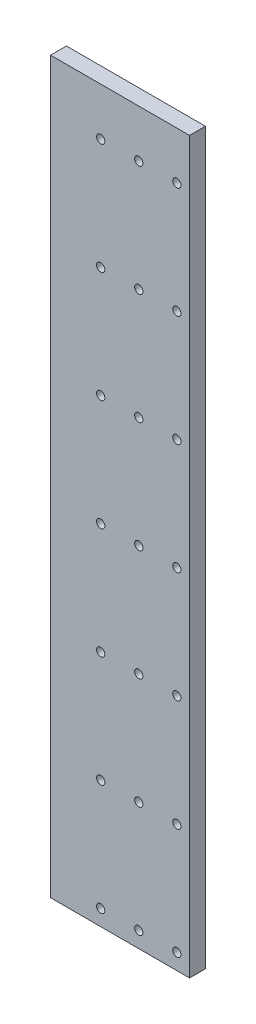
from build123d import *

# Parameters (mm, degrees)
MAIN_W                                    = 43.8
MAIN_H                                    = 230
MAIN_EXTRUSION_DEPTH                      = 2.5
MAIN_FIX_SKETCH_W                         = 8
MAIN_FIX_SKETCH_H                         = 230
MAIN_FIX_EXTRUSION_DEPTH                  = 2.5
MAIN_FIX_HOLE_SKETCH_R                    = 1.3
MAIN_FIX_HOLE_DEPTH                       = 250.664571611
MAIN_FIX_HOLE_HORIZONTAL_REPEAT_COUNT     = 3
MAIN_FIX_HOLE_HORIZONTAL_REPEAT_PITCH     = 12
FIX_HOLE_VERTICAL_REPEAT_COUNT            = 7
FIX_HOLE_VERTICAL_REPEAT_PITCH            = 35
FIX_HOLE_VERTICAL_REPEAT_COPY_1_SKETCH_R  = 1.3
FIX_HOLE_VERTICAL_REPEAT_COPY_1_DEPTH     = 250.664571611
FIX_HOLE_VERTICAL_REPEAT_COPY_2_SKETCH_R  = 1.3
FIX_HOLE_VERTICAL_REPEAT_COPY_2_DEPTH     = 250.664571611
FIX_HOLE_VERTICAL_REPEAT_COPY_3_SKETCH_R  = 1.3
FIX_HOLE_VERTICAL_REPEAT_COPY_3_DEPTH     = 250.664571611
FIX_HOLE_VERTICAL_REPEAT_COPY_4_SKETCH_R  = 1.3
FIX_HOLE_VERTICAL_REPEAT_COPY_4_DEPTH     = 250.664571611
FIX_HOLE_VERTICAL_REPEAT_COPY_5_SKETCH_R  = 1.3
FIX_HOLE_VERTICAL_REPEAT_COPY_5_DEPTH     = 250.664571611
FIX_HOLE_VERTICAL_REPEAT_COPY_6_SKETCH_R  = 1.3
FIX_HOLE_VERTICAL_REPEAT_COPY_6_DEPTH     = 250.664571611
FIX_HOLE_VERTICAL_REPEAT_COPY_7_SKETCH_R  = 1.3
FIX_HOLE_VERTICAL_REPEAT_COPY_7_DEPTH     = 250.664571611
FIX_HOLE_VERTICAL_REPEAT_COPY_8_SKETCH_R  = 1.3
FIX_HOLE_VERTICAL_REPEAT_COPY_8_DEPTH     = 250.664571611
FIX_HOLE_VERTICAL_REPEAT_COPY_9_SKETCH_R  = 1.3
FIX_HOLE_VERTICAL_REPEAT_COPY_9_DEPTH     = 250.664571611
FIX_HOLE_VERTICAL_REPEAT_COPY_10_SKETCH_R = 1.3
FIX_HOLE_VERTICAL_REPEAT_COPY_10_DEPTH    = 250.664571611
FIX_HOLE_VERTICAL_REPEAT_COPY_11_SKETCH_R = 1.3
FIX_HOLE_VERTICAL_REPEAT_COPY_11_DEPTH    = 250.664571611
FIX_HOLE_VERTICAL_REPEAT_COPY_12_SKETCH_R = 1.3
FIX_HOLE_VERTICAL_REPEAT_COPY_12_DEPTH    = 250.664571611
VERTICAL_RAINURE_W                        = 5
VERTICAL_RAINURE_H                        = 230
VERTICAL_RAINURE_EXTRUSION_DEPTH          = 2.5
HORIZONTAL_RAINURE_W                      = 30.8
HORIZONTAL_RAINURE_H                      = 6
HORIZONTAL_RAINURE_EXTRUSION_DEPTH        = 2.5
R_P_TITION_LIN_AIRE1_COUNT                = 8
R_P_TITION_LIN_AIRE1_PITCH                = 32
R_P_TITION_LIN_AIRE2_COUNT                = 2
R_P_TITION_LIN_AIRE2_PITCH                = 18
SLOT_SKETCH_EXTRUSION_DEPTH               = 40
CLIP_FIX_SKETCH_W                         = 2
CLIP_FIX_SKETCH_H                         = 4
SLOT_HOLE_SKETCH_R                        = 1.3
SLOT_HOLE_EXTRUSION_DEPTH                 = 246.570845175
SLOT_HOLE_HEAD_R                          = 3
SLOT_HOLE_HEAD_EXTRUSION_DEPTH            = 3
R_P_TITION_LIN_AIRE3_COUNT                = 3
R_P_TITION_LIN_AIRE3_PITCH                = 80


with BuildPart() as part:
    # Main → Main Extrusion (new body)
    with BuildSketch(Plane.XY):
        with Locations((46.710482565, 125)):
            Rectangle(MAIN_W, MAIN_H)
    extrude(amount=MAIN_EXTRUSION_DEPTH)

    # Main Fix Sketch → Main Fix - Extrusion (add)
    with BuildSketch(Plane(origin=(0, 0, 0), x_dir=(-1, 0, 0), z_dir=(0, 0, -1))):
        with Locations((-64.610482565, 125)):
            Rectangle(MAIN_FIX_SKETCH_W, MAIN_FIX_SKETCH_H)
    extrude(amount=MAIN_FIX_EXTRUSION_DEPTH)

    # Main Fix Hole Sketch → Main Fix Hole (cut, through all)
    with BuildSketch(Plane.XY.offset(2.5)):
        with Locations((64.610482565, 225)):
            Circle(MAIN_FIX_HOLE_SKETCH_R)
    main_fix_hole = extrude(amount=-MAIN_FIX_HOLE_DEPTH, mode=Mode.SUBTRACT)

    # Main Fix Hole Horizontal Repeat: Main Fix Hole ×3
    with Locations(*[(-i * MAIN_FIX_HOLE_HORIZONTAL_REPEAT_PITCH, 0, 0) for i in range(1, MAIN_FIX_HOLE_HORIZONTAL_REPEAT_COUNT)]):
        add(main_fix_hole, mode=Mode.SUBTRACT)

    # Fix Hole Vertical Repeat: Main Fix Hole ×7
    with Locations(*[(0, -i * FIX_HOLE_VERTICAL_REPEAT_PITCH, 0) for i in range(1, FIX_HOLE_VERTICAL_REPEAT_COUNT)]):
        add(main_fix_hole, mode=Mode.SUBTRACT)

    # Fix Hole Vertical Repeat copy 1 sketch → Fix Hole Vertical Repeat copy 1 (cut, through all)
    with BuildSketch(Plane(origin=(-12, -35, 2.5), x_dir=(1, 0, 0), z_dir=(0, 0, 1))):
        with Locations((64.610482565, 225)):
            Circle(FIX_HOLE_VERTICAL_REPEAT_COPY_1_SKETCH_R)
    extrude(amount=-FIX_HOLE_VERTICAL_REPEAT_COPY_1_DEPTH, mode=Mode.SUBTRACT)

    # Fix Hole Vertical Repeat copy 2 sketch → Fix Hole Vertical Repeat copy 2 (cut, through all)
    with BuildSketch(Plane(origin=(-12, -70, 2.5), x_dir=(1, 0, 0), z_dir=(0, 0, 1))):
        with Locations((64.610482565, 225)):
            Circle(FIX_HOLE_VERTICAL_REPEAT_COPY_2_SKETCH_R)
    extrude(amount=-FIX_HOLE_VERTICAL_REPEAT_COPY_2_DEPTH, mode=Mode.SUBTRACT)

    # Fix Hole Vertical Repeat copy 3 sketch → Fix Hole Vertical Repeat copy 3 (cut, through all)
    with BuildSketch(Plane(origin=(-12, -105, 2.5), x_dir=(1, 0, 0), z_dir=(0, 0, 1))):
        with Locations((64.610482565, 225)):
            Circle(FIX_HOLE_VERTICAL_REPEAT_COPY_3_SKETCH_R)
    extrude(amount=-FIX_HOLE_VERTICAL_REPEAT_COPY_3_DEPTH, mode=Mode.SUBTRACT)

    # Fix Hole Vertical Repeat copy 4 sketch → Fix Hole Vertical Repeat copy 4 (cut, through all)
    with BuildSketch(Plane(origin=(-12, -140, 2.5), x_dir=(1, 0, 0), z_dir=(0, 0, 1))):
        with Locations((64.610482565, 225)):
            Circle(FIX_HOLE_VERTICAL_REPEAT_COPY_4_SKETCH_R)
    extrude(amount=-FIX_HOLE_VERTICAL_REPEAT_COPY_4_DEPTH, mode=Mode.SUBTRACT)

    # Fix Hole Vertical Repeat copy 5 sketch → Fix Hole Vertical Repeat copy 5 (cut, through all)
    with BuildSketch(Plane(origin=(-12, -175, 2.5), x_dir=(1, 0, 0), z_dir=(0, 0, 1))):
        with Locations((64.610482565, 225)):
            Circle(FIX_HOLE_VERTICAL_REPEAT_COPY_5_SKETCH_R)
    extrude(amount=-FIX_HOLE_VERTICAL_REPEAT_COPY_5_DEPTH, mode=Mode.SUBTRACT)

    # Fix Hole Vertical Repeat copy 6 sketch → Fix Hole Vertical Repeat copy 6 (cut, through all)
    with BuildSketch(Plane(origin=(-12, -210, 2.5), x_dir=(1, 0, 0), z_dir=(0, 0, 1))):
        with Locations((64.610482565, 225)):
            Circle(FIX_HOLE_VERTICAL_REPEAT_COPY_6_SKETCH_R)
    extrude(amount=-FIX_HOLE_VERTICAL_REPEAT_COPY_6_DEPTH, mode=Mode.SUBTRACT)

    # Fix Hole Vertical Repeat copy 7 sketch → Fix Hole Vertical Repeat copy 7 (cut, through all)
    with BuildSketch(Plane(origin=(-24, -35, 2.5), x_dir=(1, 0, 0), z_dir=(0, 0, 1))):
        with Locations((64.610482565, 225)):
            Circle(FIX_HOLE_VERTICAL_REPEAT_COPY_7_SKETCH_R)
    extrude(amount=-FIX_HOLE_VERTICAL_REPEAT_COPY_7_DEPTH, mode=Mode.SUBTRACT)

    # Fix Hole Vertical Repeat copy 8 sketch → Fix Hole Vertical Repeat copy 8 (cut, through all)
    with BuildSketch(Plane(origin=(-24, -70, 2.5), x_dir=(1, 0, 0), z_dir=(0, 0, 1))):
        with Locations((64.610482565, 225)):
            Circle(FIX_HOLE_VERTICAL_REPEAT_COPY_8_SKETCH_R)
    extrude(amount=-FIX_HOLE_VERTICAL_REPEAT_COPY_8_DEPTH, mode=Mode.SUBTRACT)

    # Fix Hole Vertical Repeat copy 9 sketch → Fix Hole Vertical Repeat copy 9 (cut, through all)
    with BuildSketch(Plane(origin=(-24, -105, 2.5), x_dir=(1, 0, 0), z_dir=(0, 0, 1))):
        with Locations((64.610482565, 225)):
            Circle(FIX_HOLE_VERTICAL_REPEAT_COPY_9_SKETCH_R)
    extrude(amount=-FIX_HOLE_VERTICAL_REPEAT_COPY_9_DEPTH, mode=Mode.SUBTRACT)

    # Fix Hole Vertical Repeat copy 10 sketch → Fix Hole Vertical Repeat copy 10 (cut, through all)
    with BuildSketch(Plane(origin=(-24, -140, 2.5), x_dir=(1, 0, 0), z_dir=(0, 0, 1))):
        with Locations((64.610482565, 225)):
            Circle(FIX_HOLE_VERTICAL_REPEAT_COPY_10_SKETCH_R)
    extrude(amount=-FIX_HOLE_VERTICAL_REPEAT_COPY_10_DEPTH, mode=Mode.SUBTRACT)

    # Fix Hole Vertical Repeat copy 11 sketch → Fix Hole Vertical Repeat copy 11 (cut, through all)
    with BuildSketch(Plane(origin=(-24, -175, 2.5), x_dir=(1, 0, 0), z_dir=(0, 0, 1))):
        with Locations((64.610482565, 225)):
            Circle(FIX_HOLE_VERTICAL_REPEAT_COPY_11_SKETCH_R)
    extrude(amount=-FIX_HOLE_VERTICAL_REPEAT_COPY_11_DEPTH, mode=Mode.SUBTRACT)

    # Fix Hole Vertical Repeat copy 12 sketch → Fix Hole Vertical Repeat copy 12 (cut, through all)
    with BuildSketch(Plane(origin=(-24, -210, 2.5), x_dir=(1, 0, 0), z_dir=(0, 0, 1))):
        with Locations((64.610482565, 225)):
            Circle(FIX_HOLE_VERTICAL_REPEAT_COPY_12_SKETCH_R)
    extrude(amount=-FIX_HOLE_VERTICAL_REPEAT_COPY_12_DEPTH, mode=Mode.SUBTRACT)

    # Vertical Rainure → Vertical Rainure - Extrusion (add)
    with BuildSketch(Plane(origin=(0, 0, 0), x_dir=(-1, 0, 0), z_dir=(0, 0, -1))):
        with Locations((-27.310482565, 125)):
            Rectangle(VERTICAL_RAINURE_W, VERTICAL_RAINURE_H)
    vertical_rainure_extrusion = extrude(amount=VERTICAL_RAINURE_EXTRUSION_DEPTH)

    # Horizontal Rainure → Horizontal Rainure - Extrusion (add)
    with BuildSketch(Plane(origin=(0, 0, 0), x_dir=(-1, 0, 0), z_dir=(0, 0, -1))):
        with Locations((-45.210482565, 13)):
            Rectangle(HORIZONTAL_RAINURE_W, HORIZONTAL_RAINURE_H)
    horizontal_rainure_extrusion = extrude(amount=HORIZONTAL_RAINURE_EXTRUSION_DEPTH)

    # Répétition linéaire1: Horizontal Rainure - Extrusion ×8
    with Locations(*[(0, i * R_P_TITION_LIN_AIRE1_PITCH, 0) for i in range(1, R_P_TITION_LIN_AIRE1_COUNT)]):
        add(horizontal_rainure_extrusion)

    # Répétition linéaire2: Vertical Rainure - Extrusion ×2
    with Locations(*[(i * R_P_TITION_LIN_AIRE2_PITCH, 0, 0) for i in range(1, R_P_TITION_LIN_AIRE2_COUNT)]):
        add(vertical_rainure_extrusion)

    # Slot Sketch → Slot Sketch Extrusion (add)
    with BuildSketch(Plane(origin=(0, 176, 0), x_dir=(1, 0, 0), z_dir=(0, 1, 0))):
        Polygon((24.810482565, 15), (29.810482565, 15), (36.310482565, 0), (24.810482565, 0), (24.810482565, 5), (22.610482565, 5), (22.610482565, 2), (18.810482565, 5), (18.810482565, 10), (22.610482565, 13), (22.610482565, 10), (24.810482565, 10), align=None)
    slot_sketch_extrusion = extrude(amount=SLOT_SKETCH_EXTRUSION_DEPTH)

    # Clip Fix Sketch → Clip Fix Extrusion (revolve, cut)
    with BuildSketch(Plane(origin=(0, 0, -15), x_dir=(-1, 0, 0), z_dir=(0, 0, -1))):
        with Locations((-27.810482565, 180)):
            Rectangle(CLIP_FIX_SKETCH_W, CLIP_FIX_SKETCH_H)
        with Locations((-27.810482565, 212)):
            Rectangle(CLIP_FIX_SKETCH_W, CLIP_FIX_SKETCH_H)
        with Locations((-27.810482565, 203)):
            Rectangle(CLIP_FIX_SKETCH_W, CLIP_FIX_SKETCH_H)
        with Locations((-27.810482565, 189)):
            Rectangle(CLIP_FIX_SKETCH_W, CLIP_FIX_SKETCH_H)
    clip_fix_extrusion = revolve(axis=Axis((32.810482565, 252, -15), (0, -1, 0)), mode=Mode.SUBTRACT)

    # Slot Hole Sketch → Slot Hole Extrusion (cut, through all)
    with BuildSketch(Plane.ZY.offset(-18.810482565)):
        with Locations((-7.5, 196)):
            Circle(SLOT_HOLE_SKETCH_R)
    slot_hole_extrusion = extrude(amount=-SLOT_HOLE_EXTRUSION_DEPTH, mode=Mode.SUBTRACT)

    # Slot Hole Head → Slot Hole Head Extrusion (cut, symmetric)
    with BuildSketch(Plane.ZY.offset(-32.810482565)):
        with Locations((-7.5, 196)):
            Circle(SLOT_HOLE_HEAD_R)
    slot_hole_head_extrusion = extrude(amount=SLOT_HOLE_HEAD_EXTRUSION_DEPTH, both=True, mode=Mode.SUBTRACT)

    # Répétition linéaire3: Slot Sketch Extrusion, Clip Fix Extrusion, Slot Hole Extrusion, Slot Hole Head Extrusion ×3
    with Locations(*[(0, -i * R_P_TITION_LIN_AIRE3_PITCH, 0) for i in range(1, R_P_TITION_LIN_AIRE3_COUNT)]):
        add(slot_sketch_extrusion)
        add(clip_fix_extrusion, mode=Mode.SUBTRACT)
        add(slot_hole_extrusion, mode=Mode.SUBTRACT)
        add(slot_hole_head_extrusion, mode=Mode.SUBTRACT)


solid = part.part
